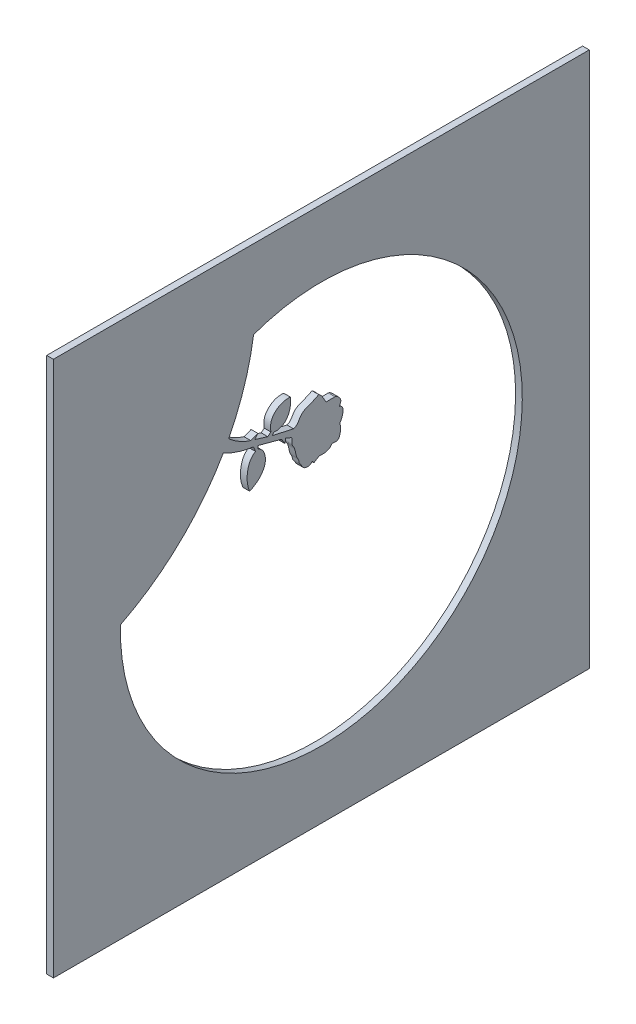
from build123d import *

# Parameters (mm, degrees)
ESQUISSE1_W        = 400
ESQUISSE1_H        = 400
ESQUISSE1_R        = 150
BOSS_EXTRU_1_DEPTH = 5
BOSS_EXTRU_2_START = -5
BOSS_EXTRU_2_DEPTH = 5
BOSS_EXTRU_3_DEPTH = 5


with BuildPart() as part:
    # Esquisse1 → Boss.-Extru.1 (new body)
    with BuildSketch(Plane(origin=(0, 0, 0), x_dir=(0, 0, -1), z_dir=(1, 0, 0))):
        Rectangle(ESQUISSE1_W, ESQUISSE1_H)
        Circle(ESQUISSE1_R, mode=Mode.SUBTRACT)
    extrude(amount=BOSS_EXTRU_1_DEPTH)

    # Esquisse2 → Boss.-Extru.2 (add)
    with BuildSketch(Plane(origin=(5, 0, 0), x_dir=(0, 0, -1), z_dir=(1, 0, 0)).offset(BOSS_EXTRU_2_START)):
        with BuildLine():
            ThreePointArc((-149.963113542, 3.326345848), (-83.411685222, 60.117854594), (-50.582353171, 141.214112424))
            ThreePointArc((-50.582353171, 141.214112424), (-121.687633298, 87.704731357), (-149.963113542, 3.326345848))
        make_face()
    extrude(amount=BOSS_EXTRU_2_DEPTH)

    # Esquisse3 → Boss.-Extru.3 (add)
    with BuildSketch(Plane(origin=(5, 0, 0), x_dir=(0, 0, -1), z_dir=(1, 0, 0))):
        with BuildLine():
            Line((-50.641756069, 68.696951836), (-49.121294777, 64.950100794))
            add(Edge.make_bspline(
                [(-49.121294777, 64.950100794), (-52.51075488, 63.09305926), (-56.251037239, 54.874213626), (-55.436032913, 45.973549374), (-53.544421741, 41.460575016)],
                knots=[0, 0, 0, 0, 0.427817388, 1, 1, 1, 1], degree=3))
            add(Edge.make_bspline(
                [(-53.544421741, 41.460575016), (-49.493771524, 43.143934267), (-43.677837846, 47.551694172), (-40.650983319, 57.726456605), (-43.687514554, 64.208576547), (-47.151888648, 65.394746752)],
                knots=[0, 0, 0, 0, 0.433456204, 0.652391978, 1, 1, 1, 1], degree=3))
            Line((-47.151888648, 65.394746752), (-47.473938049, 67.920044269))
            Line((-47.473938049, 67.920044269), (-29.771089937, 63.143994688))
            Line((-29.771089937, 63.143994688), (-27.162840794, 59.083409632))
            Line((-27.162840794, 59.083409632), (-26.639406106, 62.322569421))
            Line((-26.639406106, 62.322569421), (-22.121567137, 60.423023491))
            add(Edge.make_bspline(
                [(-22.121567137, 60.423023491), (-21.900652986, 58.844405298), (-22.593906313, 56.188877616), (-20.433988328, 53.424341294), (-19.157824546, 49.900753611), (-18.893704947, 46.014732552), (-16.715964955, 43.373118799), (-16.761241643, 40.99576311), (-14.932536534, 39.250943841), (-13.221453122, 35.220671727), (-8.354015779, 34.949952489), (-6.866737858, 37.536191267)],
                knots=[0, 0, 0, 0, 0.150869305, 0.214819056, 0.309773428, 0.491679736, 0.556111964, 0.609109072, 0.695847406, 0.772434776, 1, 1, 1, 1], degree=3))
            Line((-6.866737858, 37.536191267), (-5.513363019, 35.834805755))
            Line((-5.513363019, 35.834805755), (-1.768809898, 38.243418268))
            Line((-1.768809898, 38.243418268), (2.613795129, 38.243418268))
            Line((2.613795129, 38.243418268), (6.468274065, 39.713813265))
            Line((6.468274065, 39.713813265), (8.184977276, 41.64986563))
            Line((8.184977276, 41.64986563), (11.445710099, 41.275068754))
            add(Edge.make_bspline(
                [(11.445710099, 41.275068754), (12.91703059, 41.729549687), (14.682145059, 45.752837691), (14.248125034, 49.630437287), (13.942831767, 52.154597518)],
                knots=[0, 0, 0, 0, 0.363892157, 1, 1, 1, 1], degree=3))
            add(Edge.make_bspline(
                [(13.942831767, 52.154597518), (15.106729387, 53.423805744), (15.81295353, 55.843879283), (16.578340557, 59.892537097), (15.323868262, 62.437984958), (13.495569111, 62.795247815)],
                knots=[0, 0, 0, 0, 0.408732991, 0.60243167, 1, 1, 1, 1], degree=3))
            add(Edge.make_bspline(
                [(13.495569111, 62.795247815), (13.970078, 63.802995831), (15.705345795, 67.184562867), (12.041497459, 70.287418684), (10.116975826, 70.632248522)],
                knots=[0, 0, 0, 0, 0.344176041, 1, 1, 1, 1], degree=3))
            Line((10.116975826, 70.632248522), (3.494410121, 70.632248522))
            add(Edge.make_bspline(
                [(3.494410121, 70.632248522), (1.786435249, 73.243810631), (0.841555231, 76.383068781), (-1.984622914, 78.154912931)],
                knots=[0, 0, 0, 0, 1, 1, 1, 1], degree=3))
            add(Edge.make_bspline(
                [(-1.984622914, 78.154912931), (-4.619654468, 76.485525149), (-9.255881643, 75.250433561), (-16.519433272, 71.568054765), (-17.480141985, 66.153041817), (-20.733248382, 65.394746752)],
                knots=[0, 0, 0, 0, 0.395717089, 0.631602506, 1, 1, 1, 1], degree=3))
            Line((-20.733248382, 65.394746752), (-36.731609625, 68.966498574))
            Line((-36.731609625, 68.966498574), (-35.254584345, 70.632248522))
            add(Edge.make_bspline(
                [(-35.254584345, 70.632248522), (-33.26309679, 70.210780339), (-28.028974684, 72.174025739), (-27.339523708, 72.730784764), (-25.299138881, 75.206231145), (-23.154125649, 79.109230145), (-22.637221031, 84.197953328), (-23.001491077, 87.035020266)],
                knots=[0, 0, 0, 0, 0.05163777, 0.199516391, 0.247017501, 0.508164038, 1, 1, 1, 1], degree=3))
            add(Edge.make_bspline(
                [(-23.001491077, 87.035020266), (-27.142409249, 87.753037067), (-32.808173774, 85.571818964), (-38.094245187, 78.91770696), (-38.086684666, 74.341614121), (-37.646065549, 71.823781121)],
                knots=[0, 0, 0, 0, 0.488970635, 0.684624182, 1, 1, 1, 1], degree=3))
            Line((-37.646065549, 71.823781121), (-39.987885316, 69.960969942))
            Line((-39.987885316, 69.960969942), (-49.705455686, 72.944960143))
            Line((-49.705455686, 72.944960143), (-47.473938049, 75.865174629))
            Line((-47.473938049, 75.865174629), (-52.728820416, 73.810875285))
            add(Edge.make_bspline(
                [(-52.728820416, 73.810875285), (-65.290226854, 77.416651114), (-74.909544365, 88.095525002), (-82.830465292, 97.70673649)],
                knots=[0, 0, 0, 0, 1, 1, 1, 1], degree=3))
            Line((-82.830465292, 97.70673649), (-88.369376858, 87.035020266))
            add(Edge.make_bspline(
                [(-88.369376858, 87.035020266), (-72.280582145, 71.618587652), (-50.641756069, 68.696951836)],
                knots=[0, 0, 0, 1, 1, 1], degree=2))
        make_face()
    extrude(amount=-BOSS_EXTRU_3_DEPTH)


solid = part.part
